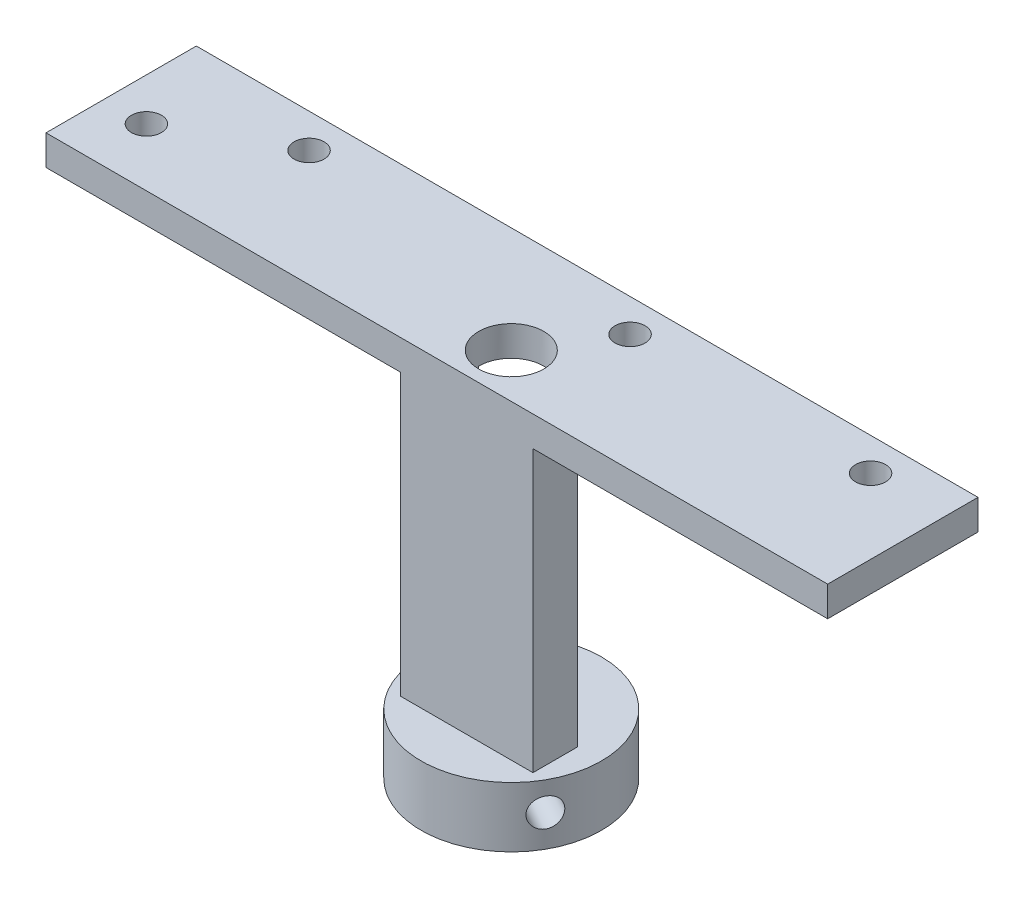
from build123d import *

# Parameters (mm, degrees)
SKETCH_1_W                = 78
SKETCH_1_H                = 15
EXTRUDE_1_DEPTH           = 3
SKETCH_3_R                = 1.5
CUT_EXTRUDE_1_DEPTH       = 3
SKETCH_4_R                = 6
EXTRUDE_2_DEPTH           = 18
SKETCH_5_R                = 4.5
CUT_EXTRUDE_2_DEPTH       = 21
F_2_0MM_2_D               = 3
F_2_0MM_2_DEPTH           = 4.5
F_2_0MM_2_TIP             = 1.5
F_2_0MM_2_ON_FACE_2_D     = 3
F_2_0MM_2_ON_FACE_2_DEPTH = 4.5
F_2_0MM_2_ON_FACE_2_TIP   = 1.5
SKETCH_10_W               = 6
SKETCH_10_H               = 10
CUT_EXTRUDE_3_DEPTH       = 7
SKETCH_13_W               = 19.835687411
SKETCH_13_H               = 21.610205193
CUT_EXTRUDE_4_DEPTH       = 20
SKETCH_14_W               = 11.523038103
SKETCH_14_H               = 10.49031299
EXTRUDE_3_DEPTH           = 3
SKETCH_18_W               = 78
SKETCH_18_H               = 8
EXTRUDE_4_DEPTH           = 3
SKETCH_19_W               = 36.767904102
SKETCH_19_H               = 2.5
EXTRUDE_5_DEPTH           = 12.5
SKETCH_23_R               = 1.65
CUT_EXTRUDE_6_DEPTH       = 12.5
SKETCH_25_W               = 4.236607592
SKETCH_25_H               = 5.36409187
EXTRUDE_7_DEPTH           = 2.5
SKETCH_26_R               = 1.6
CUT_EXTRUDE_7_DEPTH       = 2.5
SKETCH_27_W               = 21.346012392
SKETCH_27_H               = 6.594354882
EXTRUDE_8_DEPTH           = 2.5
SKETCH_28_W               = 36.767231154
SKETCH_28_H               = 5.91819544
EXTRUDE_9_DEPTH           = 2.5
SKETCH_29_W               = 27.660340415
SKETCH_29_H               = 3.5
CUT_EXTRUDE_9_DEPTH       = 2.5
SKETCH_30_W               = 78
SKETCH_30_H               = 8
CUT_EXTRUDE_10_DEPTH      = 100
SKETCH_31_W               = 60.820132647
SKETCH_31_H               = 3
EXTRUDE_10_DEPTH          = 49
SKETCH_32_W               = 48
SKETCH_32_H               = 3.2
CUT_EXTRUDE_11_DEPTH      = 49
SKETCH_33_W               = 15
SKETCH_33_H               = 49.05968874
CUT_EXTRUDE_12_DEPTH      = 100
SKETCH_34_R               = 4.25
EXTRUDE_11_DEPTH          = 49
SKETCH_35_R               = 6
EXTRUDE_12_DEPTH          = 6
SKETCH_36_W               = 8.5
SKETCH_36_H               = 40
CUT_EXTRUDE_13_DEPTH      = 11
SKETCH_37_R               = 3.25
CUT_EXTRUDE_16_DEPTH      = 100
SKETCH_39_W               = 8.456699936
SKETCH_39_H               = 16
CUT_EXTRUDE_17_DEPTH      = 1.25
F_3_0MM_1_D               = 2.85
F_3_0MM_1_DEPTH           = 4.143773618
F_3_0MM_1_TIP             = 0.856226382
F_3_0MM_2_D               = 2.85
F_3_0MM_2_DEPTH           = 4.143773618
F_3_0MM_2_TIP             = 0.856226382
F_3_0MM_3_D               = 2.85
F_3_0MM_3_DEPTH           = 4.143773618
F_3_0MM_3_TIP             = 0.856226382
SKETCH_46_W               = 13.227107738
SKETCH_46_H               = 4.428434999
EXTRUDE_13_DEPTH          = 46
CUT_EXTRUDE_18_DEPTH      = 55
EXTRUDE_START             = 15
EXTRUDE_14_DEPTH          = 15
SKETCH_50_R               = 1.5
CUT_EXTRUDE_19_DEPTH      = 15
SKETCH_51_R               = 1.5
CUT_EXTRUDE_20_DEPTH      = 15
SKETCH_52_R               = 1.5
CUT_EXTRUDE_21_DEPTH      = 15
SKETCH_53_R               = 1.5
CUT_EXTRUDE_22_DEPTH      = 15
SKETCH_54_W               = 78
SKETCH_54_H               = 15
CUT_EXTRUDE_23_DEPTH      = 15
F_3_0MM_4_D               = 2.85
F_3_0MM_4_DEPTH           = 4.143773618
F_3_0MM_4_TIP             = 0.856226382
F_3_0MM_5_D               = 2.85
F_3_0MM_5_DEPTH           = 4.143773618
F_3_0MM_5_TIP             = 0.856226382
SKETCH_60_R               = 9
EXTRUDE_15_DEPTH          = 6
CUT_EXTRUDE_START         = -6
SKETCH_61_R               = 3.25
CUT_EXTRUDE_24_DEPTH      = 6
F_3_0MM_6_D               = 2.85
F_3_0MM_6_DEPTH           = 9.143773618
F_3_0MM_6_TIP             = 0.856226382
F_3_0MM_7_D               = 2.85
F_3_0MM_7_DEPTH           = 9.143773618
F_3_0MM_7_TIP             = 0.856226382
F_3_0MM_7_ON_FACE_2_D     = 2.85
F_3_0MM_7_ON_FACE_2_DEPTH = 9.143773618
F_3_0MM_7_ON_FACE_2_TIP   = 0.856226382


with BuildPart() as part:
    # 草图1 → 凸台-拉伸1 (new body)
    with BuildSketch(Plane(origin=(0, 0, 0), x_dir=(1, 0, 0), z_dir=(0, 1, 0))):
        Rectangle(SKETCH_1_W, SKETCH_1_H)
    extrude(amount=EXTRUDE_1_DEPTH)

    # 草图3 → 切除-拉伸1 (cut)
    with BuildSketch(Plane(origin=(0, 3, 0), x_dir=(1, 0, 0), z_dir=(0, 1, 0))):
        with Locations(Location((-34.76, -1.72, 0), (0, 0, 270))):
            Circle(SKETCH_3_R)
        with Locations(Location((-24.35, 4.1, 0), (0, 0, 270))):
            Circle(SKETCH_3_R)
        with Locations(Location((31.56, 4.221692081, 0), (0, 0, 270))):
            Circle(SKETCH_3_R)
        with Locations(Location((7.56, 4.221692081, 0), (0, 0, 270))):
            Circle(SKETCH_3_R)
    extrude(amount=-CUT_EXTRUDE_1_DEPTH, mode=Mode.SUBTRACT)

    # 草图4 → 凸台-拉伸2 (add)
    with BuildSketch(Plane(origin=(0, 3, 0), x_dir=(1, 0, 0), z_dir=(0, 1, 0))):
        with Locations(Location((-3, -1.234165229, 0), (0, 0, 270))):
            Circle(SKETCH_4_R)
    extrude(amount=EXTRUDE_2_DEPTH)

    # 草图5 → 切除-拉伸2 (cut)
    with BuildSketch(Plane(origin=(0, 21, 0), x_dir=(1, 0, 0), z_dir=(0, 1, 0))):
        with Locations(Location((-3, -1.234165229, 0), (0, 0, 270))):
            Circle(SKETCH_5_R)
    extrude(amount=-CUT_EXTRUDE_2_DEPTH, mode=Mode.SUBTRACT)

    # Ø2.0mm 暗销孔2
    with Locations(Plane(origin=(-7.901331048, 17.342107422, 4.694938836), x_dir=(-0.576795601176, 0, -0.816888507977), z_dir=(-0.816888507977, 0, 0.576795601176))):
        with Locations((0, 0)):
            Hole(F_2_0MM_2_D / 2, depth=F_2_0MM_2_DEPTH)
            with Locations((0, 0, -(F_2_0MM_2_DEPTH + F_2_0MM_2_TIP / 2))):  # 90° drill point
                Cone(0, F_2_0MM_2_D / 2, F_2_0MM_2_TIP, mode=Mode.SUBTRACT)

    # Ø2.0mm 暗销孔2 on face 2
    with Locations(Plane(origin=(1.071764877, 17.164817099, 5.641061052), x_dir=(0.734483043181, 0, -0.678627039897), z_dir=(0.678627039897, 0, 0.734483043181))):
        with Locations((0, 0)):
            Hole(F_2_0MM_2_ON_FACE_2_D / 2, depth=F_2_0MM_2_ON_FACE_2_DEPTH)
            with Locations((0, 0, -(F_2_0MM_2_ON_FACE_2_DEPTH + F_2_0MM_2_ON_FACE_2_TIP / 2))):  # 90° drill point
                Cone(0, F_2_0MM_2_ON_FACE_2_D / 2, F_2_0MM_2_ON_FACE_2_TIP, mode=Mode.SUBTRACT)

    # 草图10 → 切除-拉伸3 (cut)
    with BuildSketch(Plane(origin=(0, 0, -7.5), x_dir=(-1, 0, 0), z_dir=(0, 0, -1))):
        with Locations((3, 8)):
            Rectangle(SKETCH_10_W, SKETCH_10_H)
    extrude(amount=-CUT_EXTRUDE_3_DEPTH, mode=Mode.SUBTRACT)

    # 草图13 → 切除-拉伸4 (cut)
    with BuildSketch(Plane(origin=(0, 0, -7.5), x_dir=(-1, 0, 0), z_dir=(0, 0, -1))):
        with Locations((3.314421038, 13.805102597)):
            Rectangle(SKETCH_13_W, SKETCH_13_H)
    extrude(amount=-CUT_EXTRUDE_4_DEPTH, mode=Mode.SUBTRACT)

    # 草图14 → 凸台-拉伸3 (add)
    with BuildSketch(Plane(origin=(0, 3, 0), x_dir=(1, 0, 0), z_dir=(0, 1, 0))):
        with Locations((-2.989467433, -1.263493391)):
            Rectangle(SKETCH_14_W, SKETCH_14_H)
    extrude(amount=-EXTRUDE_3_DEPTH)

    # 草图18 → 凸台-拉伸4 (add)
    with BuildSketch(Plane.XZ):
        with Locations((0, 11.5)):
            Rectangle(SKETCH_18_W, SKETCH_18_H)
    extrude(amount=-EXTRUDE_4_DEPTH)

    # 草图19 → 凸台-拉伸5 (add)
    with BuildSketch(Plane.XZ):
        with Locations((0.839237194, 14.25)):
            Rectangle(SKETCH_19_W, SKETCH_19_H)
    extrude(amount=EXTRUDE_5_DEPTH)

    # 草图23 → 切除-拉伸6 (cut)
    with BuildSketch(Plane(origin=(0, 0, 13), x_dir=(-1, 0, 0), z_dir=(0, 0, -1))):
        with Locations((-8.603189245, -6.05592298)):
            Circle(SKETCH_23_R)
        with Locations((2.596810755, -6.05592298)):
            Circle(SKETCH_23_R)
    extrude(amount=-CUT_EXTRUDE_6_DEPTH, mode=Mode.SUBTRACT)

    # 草图25 → 凸台-拉伸7 (add)
    with BuildSketch(Plane(origin=(0, 0, 13), x_dir=(-1, 0, 0), z_dir=(0, 0, -1))):
        with Locations((2.330668631, -6.426480946)):
            Rectangle(SKETCH_25_W, SKETCH_25_H)
    extrude(amount=-EXTRUDE_7_DEPTH)

    # 草图26 → 切除-拉伸7 (cut)
    with BuildSketch(Plane(origin=(0, 0, 13), x_dir=(-1, 0, 0), z_dir=(0, 0, -1))):
        with Locations((4.196810755, -6.05592298)):
            Circle(SKETCH_26_R)
    extrude(amount=-CUT_EXTRUDE_7_DEPTH, mode=Mode.SUBTRACT)

    # 草图27 → 凸台-拉伸8 (add)
    with BuildSketch(Plane(origin=(0, 0, 13), x_dir=(-1, 0, 0), z_dir=(0, 0, -1))):
        with Locations((-2.379316694, -6.691741876)):
            Rectangle(SKETCH_27_W, SKETCH_27_H)
    extrude(amount=-EXTRUDE_8_DEPTH)

    # 草图28 → 凸台-拉伸9 (add)
    with BuildSketch(Plane(origin=(0, 0, 13), x_dir=(-1, 0, 0), z_dir=(0, 0, -1))):
        with Locations((-0.839573668, -15.45909772)):
            Rectangle(SKETCH_28_W, SKETCH_28_H)
    extrude(amount=-EXTRUDE_9_DEPTH)

    # 草图29 → 切除-拉伸9 (cut)
    with BuildSketch(Plane(origin=(0, 0, 13), x_dir=(-1, 0, 0), z_dir=(0, 0, -1))):
        with Locations((-0.633763758, -13.394190827)):
            Rectangle(SKETCH_29_W, SKETCH_29_H)
    extrude(amount=-CUT_EXTRUDE_9_DEPTH, mode=Mode.SUBTRACT)

    # 草图30 → 切除-拉伸10 (cut)
    with BuildSketch(Plane(origin=(0, 3, 0), x_dir=(1, 0, 0), z_dir=(0, 1, 0))):
        with Locations((0, -11.5)):
            Rectangle(SKETCH_30_W, SKETCH_30_H)
    extrude(amount=-CUT_EXTRUDE_10_DEPTH, mode=Mode.SUBTRACT)

    # 草图31 → 凸台-拉伸10 (add)
    with BuildSketch(Plane.XZ):
        with Locations((0.65611444, 6)):
            Rectangle(SKETCH_31_W, SKETCH_31_H)
    extrude(amount=EXTRUDE_10_DEPTH)

    # 草图32 → 切除-拉伸11 (cut)
    with BuildSketch(Plane(origin=(0, 0, 4.5), x_dir=(-1, 0, 0), z_dir=(0, 0, -1))):
        with Locations((-0.175604554, -15.854114518)):
            Rectangle(SKETCH_32_W, SKETCH_32_H)
        with Locations((-0.205191163, -23.054114518)):
            Rectangle(SKETCH_32_W, SKETCH_32_H)
        with Locations((-0.173277927, -30.254114518)):
            Rectangle(SKETCH_32_W, SKETCH_32_H)
        with Locations((-0.15338956, -37.454114518)):
            Rectangle(SKETCH_32_W, SKETCH_32_H)
        with Locations((-0.189333293, -44.654114518)):
            Rectangle(SKETCH_32_W, SKETCH_32_H)
        with Locations((-0.276259634, -9.654114518)):
            Rectangle(SKETCH_32_W, SKETCH_32_H)
    extrude(amount=-CUT_EXTRUDE_11_DEPTH, mode=Mode.SUBTRACT)

    # 草图33 → 切除-拉伸12 (cut)
    with BuildSketch(Plane(origin=(31.066180764, 0, 0), x_dir=(0, 0, -1), z_dir=(1, 0, 0))):
        with Locations((0, -24.52984437)):
            Rectangle(SKETCH_33_W, SKETCH_33_H)
    extrude(amount=-CUT_EXTRUDE_12_DEPTH, mode=Mode.SUBTRACT)

    # 草图34 → 凸台-拉伸11 (add)
    with BuildSketch(Plane.XZ):
        with Locations(Location((3, 3.071565001, 0), (0, 0, 90))):
            Circle(SKETCH_34_R)
    extrude(amount=EXTRUDE_11_DEPTH)

    # 草图35 → 凸台-拉伸12 (add)
    with BuildSketch(Plane.XZ.offset(49)):
        with Locations(Location((3, 3.071565001, 0), (0, 0, 270))):
            Circle(SKETCH_35_R)
    extrude(amount=-EXTRUDE_12_DEPTH)

    # 草图36 → 切除-拉伸13 (cut)
    with BuildSketch(Plane(origin=(0, 0, -7.5), x_dir=(-1, 0, 0), z_dir=(0, 0, -1))):
        with Locations((-3, -20)):
            Rectangle(SKETCH_36_W, SKETCH_36_H)
    extrude(amount=-CUT_EXTRUDE_13_DEPTH, mode=Mode.SUBTRACT)

    # 草图37 → 切除-拉伸16 (cut)
    with BuildSketch(Plane.XZ.offset(49)):
        with Locations(Location((3, 3.071565001, 0), (0, 0, 270))):
            Circle(SKETCH_37_R)
    extrude(amount=-CUT_EXTRUDE_16_DEPTH, mode=Mode.SUBTRACT)

    # 草图39 → 切除-拉伸17 (cut)
    with BuildSketch(Plane(origin=(0, 0, 3.5), x_dir=(-1, 0, 0), z_dir=(0, 0, -1))):
        with Locations((-3, -32)):
            Rectangle(SKETCH_39_W, SKETCH_39_H)
    extrude(amount=-CUT_EXTRUDE_17_DEPTH, mode=Mode.SUBTRACT)

    # Ø3.0mm 暗销孔1
    with Locations(Plane(origin=(3.06916604, -45.926554475, -2.928036324), x_dir=(-0.999933554166, 0, -0.011527673319), z_dir=(0.011527673319, 0, -0.999933554166))):
        with Locations((0, 0)):
            Hole(F_3_0MM_1_D / 2, depth=F_3_0MM_1_DEPTH)
            with Locations((0, 0, -(F_3_0MM_1_DEPTH + F_3_0MM_1_TIP / 2))):  # 118° drill point
                Cone(0, F_3_0MM_1_D / 2, F_3_0MM_1_TIP, mode=Mode.SUBTRACT)

    # Ø3.0mm 暗销孔2
    with Locations(Plane(origin=(-2.19436254, -45.980907568, 6.074663036), x_dir=(-0.500516339146, 0, -0.865727089936), z_dir=(-0.865727089936, 0, 0.500516339146))):
        with Locations((0, 0)):
            Hole(F_3_0MM_2_D / 2, depth=F_3_0MM_2_DEPTH)
            with Locations((0, 0, -(F_3_0MM_2_DEPTH + F_3_0MM_2_TIP / 2))):  # 118° drill point
                Cone(0, F_3_0MM_2_D / 2, F_3_0MM_2_TIP, mode=Mode.SUBTRACT)

    # Ø3.0mm 暗销孔3
    with Locations(Plane(origin=(8.205806468, -46.039954185, 6.054781221), x_dir=(-0.497202703373, 0, 0.86763441135), z_dir=(0.86763441135, 0, 0.497202703373))):
        with Locations((0, 0)):
            Hole(F_3_0MM_3_D / 2, depth=F_3_0MM_3_DEPTH)
            with Locations((0, 0, -(F_3_0MM_3_DEPTH + F_3_0MM_3_TIP / 2))):  # 118° drill point
                Cone(0, F_3_0MM_3_D / 2, F_3_0MM_3_TIP, mode=Mode.SUBTRACT)

    # 草图46 → 凸台-拉伸13 (add)
    with BuildSketch(Plane(origin=(0, 3, 0), x_dir=(1, 0, 0), z_dir=(0, 1, 0))):
        with Locations((2.976074231, -5.285782501)):
            Rectangle(SKETCH_46_W, SKETCH_46_H)
    extrude(amount=-EXTRUDE_13_DEPTH)

    # 草图48 → 切除-拉伸18 (cut)
    with BuildSketch(Plane.XZ.offset(49)):
        with BuildLine():
            Line((-0.25, 3.071565001), (6.25, 3.071565001))
            ThreePointArc((6.25, 3.071565001), (3, 6.321565001), (-0.25, 3.071565001))
        make_face()
    extrude(amount=-CUT_EXTRUDE_18_DEPTH, mode=Mode.SUBTRACT)

    # 草图49 → 凸台-拉伸14 (add)
    with BuildSketch(Plane.XZ.offset(EXTRUDE_START)):
        with BuildLine():
            Line((-0.25, 3.071565001), (-3.637479638, 3.071565001))
            Line((-3.637479638, 3.071565001), (-3.637479638, 7.5))
            Line((-3.637479638, 7.5), (-39, 7.5))
            Line((-39, 7.5), (-39, -7.5))
            Line((-39, -7.5), (39, -7.5))
            Line((39, -7.5), (39, 7.5))
            Line((39, 7.5), (9.5896281, 7.5))
            Line((9.5896281, 7.5), (9.5896281, 3.071565001))
            Line((9.5896281, 3.071565001), (6.25, 3.071565001))
            ThreePointArc((6.25, 3.071565001), (3, -0.178434999), (-0.25, 3.071565001))
        make_face()
    extrude(amount=-EXTRUDE_14_DEPTH)

    # 草图50 → 切除-拉伸19 (cut)
    with BuildSketch(Plane(origin=(0, 0, 0), x_dir=(1, 0, 0), z_dir=(0, 1, 0))):
        with Locations(Location((-34.76, -1.72, 0), (0, 0, 270))):
            Circle(SKETCH_50_R)
    extrude(amount=-CUT_EXTRUDE_19_DEPTH, mode=Mode.SUBTRACT)

    # 草图51 → 切除-拉伸20 (cut)
    with BuildSketch(Plane(origin=(0, 0, 0), x_dir=(1, 0, 0), z_dir=(0, 1, 0))):
        with Locations(Location((-24.35, 4.1, 0), (0, 0, 270))):
            Circle(SKETCH_51_R)
    extrude(amount=-CUT_EXTRUDE_20_DEPTH, mode=Mode.SUBTRACT)

    # 草图52 → 切除-拉伸21 (cut)
    with BuildSketch(Plane(origin=(0, 0, 0), x_dir=(1, 0, 0), z_dir=(0, 1, 0))):
        with Locations(Location((7.56, 4.221692081, 0), (0, 0, 270))):
            Circle(SKETCH_52_R)
    extrude(amount=-CUT_EXTRUDE_21_DEPTH, mode=Mode.SUBTRACT)

    # 草图53 → 切除-拉伸22 (cut)
    with BuildSketch(Plane(origin=(0, 0, 0), x_dir=(1, 0, 0), z_dir=(0, 1, 0))):
        with Locations(Location((31.56, 4.221692081, 0), (0, 0, 270))):
            Circle(SKETCH_53_R)
    extrude(amount=-CUT_EXTRUDE_22_DEPTH, mode=Mode.SUBTRACT)

    # 草图54 → 切除-拉伸23 (cut)
    with BuildSketch(Plane(origin=(0, 3, 0), x_dir=(1, 0, 0), z_dir=(0, 1, 0))):
        Rectangle(SKETCH_54_W, SKETCH_54_H)
    extrude(amount=-CUT_EXTRUDE_23_DEPTH, mode=Mode.SUBTRACT)

    # Ø3.0mm 暗销孔4
    with Locations(Plane(origin=(-2.206820669, -45.974417651, 0.09011929), x_dir=(0.496907618427, 0, -0.867803444767), z_dir=(-0.867803444767, 0, -0.496907618427))):
        with Locations((0, 0)):
            Hole(F_3_0MM_4_D / 2, depth=F_3_0MM_4_DEPTH)
            with Locations((0, 0, -(F_3_0MM_4_DEPTH + F_3_0MM_4_TIP / 2))):  # 118° drill point
                Cone(0, F_3_0MM_4_D / 2, F_3_0MM_4_TIP, mode=Mode.SUBTRACT)

    # Ø3.0mm 暗销孔5
    with Locations(Plane(origin=(8.192046128, -46.012961975, 0.064463904), x_dir=(0.501183516141, 0, 0.865341021303), z_dir=(0.865341021303, 0, -0.501183516141))):
        with Locations((0, 0)):
            Hole(F_3_0MM_5_D / 2, depth=F_3_0MM_5_DEPTH)
            with Locations((0, 0, -(F_3_0MM_5_DEPTH + F_3_0MM_5_TIP / 2))):  # 118° drill point
                Cone(0, F_3_0MM_5_D / 2, F_3_0MM_5_TIP, mode=Mode.SUBTRACT)

    # 草图60 → 凸台-拉伸15 (add)
    with BuildSketch(Plane.XZ.offset(49)):
        with Locations(Location((3, 3.071565001, 0), (0, 0, 270))):
            Circle(SKETCH_60_R)
    extrude(amount=-EXTRUDE_15_DEPTH)

    # 草图61 → 切除-拉伸24 (cut)
    with BuildSketch(Plane(origin=(0, -43, 0), x_dir=(1, 0, 0), z_dir=(0, 1, 0)).offset(CUT_EXTRUDE_START)):
        with Locations(Location((3, -3.071565001, 0), (0, 0, 270))):
            Circle(SKETCH_61_R)
    extrude(amount=CUT_EXTRUDE_24_DEPTH, mode=Mode.SUBTRACT)

    # Ø3.0mm 暗销孔6
    with Locations(Plane(origin=(3.050736778, -46.031856967, -5.928291986), x_dir=(-0.999984109623, 0, -0.00563741982), z_dir=(0.00563741982, 0, -0.999984109623))):
        with Locations((0, 0)):
            Hole(F_3_0MM_6_D / 2, depth=F_3_0MM_6_DEPTH)
            with Locations((0, 0, -(F_3_0MM_6_DEPTH + F_3_0MM_6_TIP / 2))):  # 118° drill point
                Cone(0, F_3_0MM_6_D / 2, F_3_0MM_6_TIP, mode=Mode.SUBTRACT)

    # Ø3.0mm 暗销孔7
    with Locations(Plane(origin=(10.848450321, -45.825193133, 7.476315567), x_dir=(-0.489416729598, 0, 0.872050035715), z_dir=(0.872050035715, 0, 0.489416729598))):
        with Locations((0, 0)):
            Hole(F_3_0MM_7_D / 2, depth=F_3_0MM_7_DEPTH)
            with Locations((0, 0, -(F_3_0MM_7_DEPTH + F_3_0MM_7_TIP / 2))):  # 118° drill point
                Cone(0, F_3_0MM_7_D / 2, F_3_0MM_7_TIP, mode=Mode.SUBTRACT)

    # Ø3.0mm 暗销孔7 on face 2
    with Locations(Plane(origin=(-4.772770579, -45.937170264, 7.608528471), x_dir=(-0.504107089648, 0, -0.863641153586), z_dir=(-0.863641153586, 0, 0.504107089648))):
        with Locations((0, 0)):
            Hole(F_3_0MM_7_ON_FACE_2_D / 2, depth=F_3_0MM_7_ON_FACE_2_DEPTH)
            with Locations((0, 0, -(F_3_0MM_7_ON_FACE_2_DEPTH + F_3_0MM_7_ON_FACE_2_TIP / 2))):  # 118° drill point
                Cone(0, F_3_0MM_7_ON_FACE_2_D / 2, F_3_0MM_7_ON_FACE_2_TIP, mode=Mode.SUBTRACT)


solid = part.part
